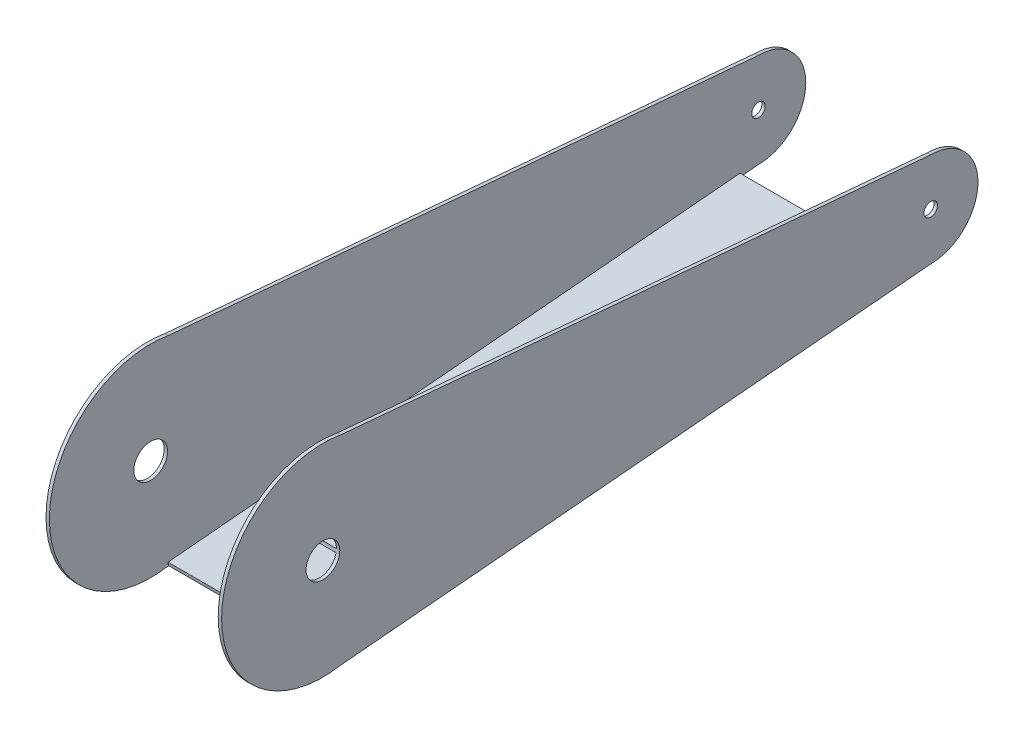
from build123d import *

# Parameters (mm, degrees)
SKETCH1_R           = 5
SKETCH1_R_2         = 2.5
BOSS_EXTRUDE1_DEPTH = 26
CUT_EXTRUDE1_DEPTH  = 25
SKETCH5_R           = 2.67469655
SKETCH5_R_2         = 2
BOSS_EXTRUDE2_DEPTH = 1
BOSS_EXTRUDE3_START = -1
SKETCH6_R           = 2.5
SKETCH6_R_2         = 2
BOSS_EXTRUDE3_DEPTH = 1
BOSS_EXTRUDE4_START = 5
BOSS_EXTRUDE4_DEPTH = 5


with BuildPart() as part:
    # Sketch1 → Boss-Extrude1 (new, symmetric)
    with BuildSketch(Plane(origin=(0, 0, 0), x_dir=(0, 0, -1), z_dir=(1, 0, 0))):
        with BuildLine():
            Line((5.291523763, 29.529642332), (180, 14))
            ThreePointArc((180, 14), (194, 0), (180, -14))
            Line((180, -14), (5.291523763, -29.529642332))
            ThreePointArc((5.291523763, -29.529642332), (-30, 0), (5.291523763, 29.529642332))
        make_face()
        with Locations(Location((0, 0, 0), (0, 0, 180))):
            Circle(SKETCH1_R, mode=Mode.SUBTRACT)
        with Locations(Location((180, 0, 0), (0, 0, 180))):
            Circle(SKETCH1_R_2, mode=Mode.SUBTRACT)
    extrude(amount=BOSS_EXTRUDE1_DEPTH, both=True)

    # Sketch2 → Cut-Extrude1 (cut, symmetric)
    with BuildSketch(Plane(origin=(0, 0, 0), x_dir=(0, 0, -1), z_dir=(1, 0, 0))):
        with BuildLine():
            Line((5.291523763, -29.529642332), (5.114444182, -28.541439895))
            Line((5.114444182, -28.541439895), (174.506520913, -13.484366408))
            Line((174.506520913, -13.484366408), (174.595060704, -14.480439049))
            Line((174.595060704, -14.480439049), (180, -14))
            ThreePointArc((180, -14), (194, 0), (180, 14))
            Line((180, 14), (5.291523763, 29.529642332))
            ThreePointArc((5.291523763, 29.529642332), (-30, 0), (5.291523763, -29.529642332))
        make_face()
    extrude(amount=CUT_EXTRUDE1_DEPTH, both=True, mode=Mode.SUBTRACT)

    # Sketch5 → Boss-Extrude2 (add)
    with BuildSketch(Plane.ZY.offset(26)):
        with Locations((-180, 0)):
            Circle(SKETCH5_R)
        with Locations((-180, 0)):
            Circle(SKETCH5_R_2, mode=Mode.SUBTRACT)
    extrude(amount=-BOSS_EXTRUDE2_DEPTH)

    # Sketch6 → Boss-Extrude3 (add)
    with BuildSketch(Plane(origin=(26, 0, 0), x_dir=(0, 0, -1), z_dir=(1, 0, 0)).offset(BOSS_EXTRUDE3_START)):
        with Locations((180, 0)):
            Circle(SKETCH6_R)
        with Locations(Location((180, 0, 0), (0, 0, 180))):
            Circle(SKETCH6_R_2, mode=Mode.SUBTRACT)
    extrude(amount=BOSS_EXTRUDE3_DEPTH)

    # Sketch7 → Boss-Extrude4 (add)
    with BuildSketch(Plane.ZY.offset(-25).offset(BOSS_EXTRUDE4_START)):
        with BuildLine():
            Line((-5, 0), (-178, 0))
            ThreePointArc((-178, 0), (-178.068148347, -0.51763809), (-178.267949192, -1))
            Line((-178.267949192, -1), (-4.898979486, -1))
            ThreePointArc((-4.898979486, -1), (-4.974680765, -0.50254481), (-5, 0))
        make_face()
    extrude(amount=-BOSS_EXTRUDE4_DEPTH)


solid = part.part
